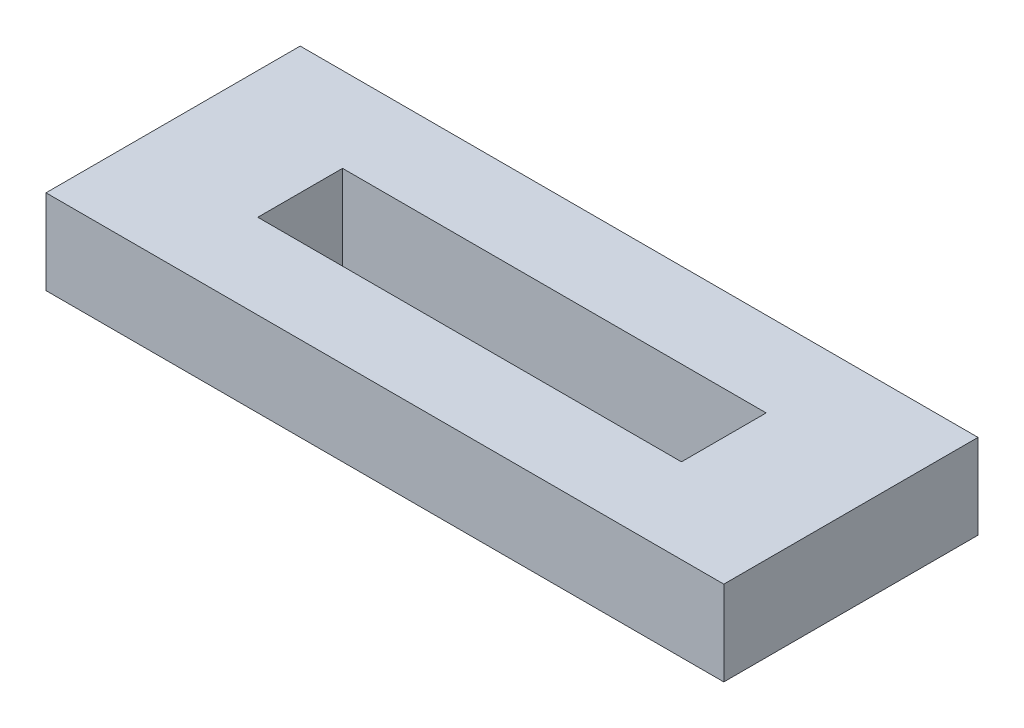
from build123d import *

# Parameters (mm, degrees)
SKETCH1_W           = 80
SKETCH1_H           = 30
SKETCH1_W_2         = 50
SKETCH1_H_2         = 10
BOSS_EXTRUDE1_DEPTH = 10


with BuildPart() as part:
    # Sketch1 → Boss-Extrude1 (new body)
    with BuildSketch(Plane(origin=(0, 0, 0), x_dir=(1, 0, 0), z_dir=(0, 1, 0))):
        Rectangle(SKETCH1_W, SKETCH1_H)
        Rectangle(SKETCH1_W_2, SKETCH1_H_2, mode=Mode.SUBTRACT)
    extrude(amount=BOSS_EXTRUDE1_DEPTH)


solid = part.part
